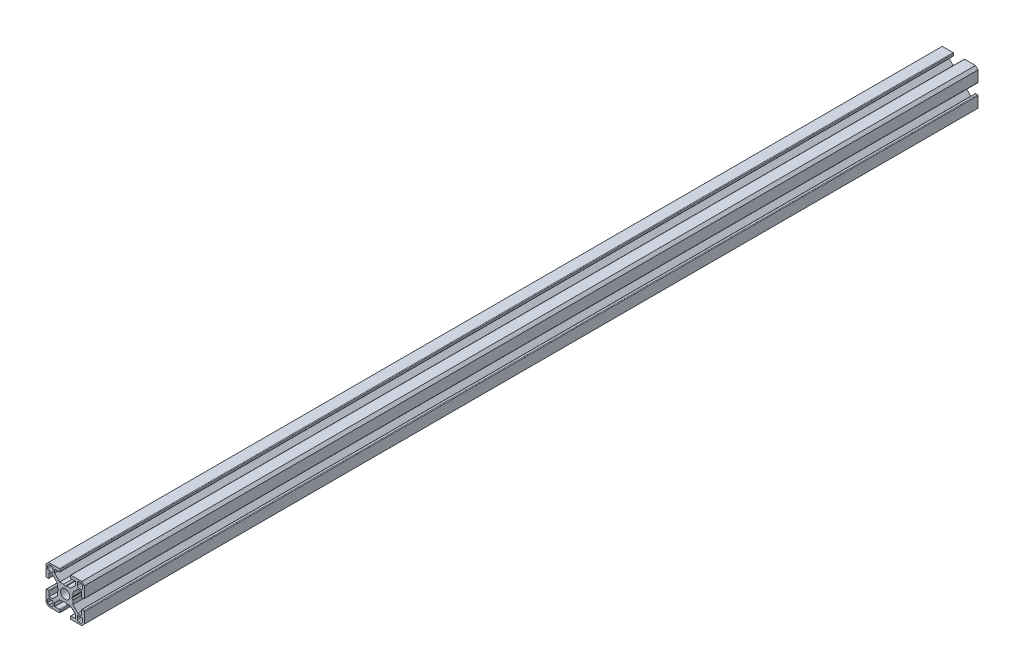
from build123d import *

# Parameters (mm, degrees)
BOSS_EXTRUDE1_DEPTH = 350
CIRPATTERN1_COUNT   = 4


with BuildPart() as part:
    # Sketch1 → Boss-Extrude1 (new, symmetric)
    with BuildSketch(Plane(origin=(0, 0, 0), x_dir=(0, -1, 0), z_dir=(0, 0, 1))):
        with BuildLine():
            Line((0, 5.3), (0, 3.65))
            ThreePointArc((0, 3.65), (-2.580939751, 2.580939751), (-3.65, 0))
            Line((-3.65, 0), (-5.3, 0))
            Line((-5.3, 0), (-6, 1.25))
            Line((-6, 1.25), (-6, 4.232224593))
            Line((-6, 4.232224593), (-10.01775891, 8.249983504))
            Line((-10.01775891, 8.249983504), (-12.68, 8.249983504))
            Line((-12.68, 8.249983504), (-12.68, 4.549990808))
            ThreePointArc((-12.68, 4.549990808), (-12.826446609, 4.196437418), (-13.18, 4.049990808))
            Line((-13.18, 4.049990808), (-14.5, 4.049990808))
            ThreePointArc((-14.5, 4.049990808), (-14.853553391, 4.196437418), (-15, 4.549990808))
            Line((-15, 4.549990808), (-15, 13))
            Line((-15, 13), (-13, 15))
            Line((-13, 15), (-4.549990808, 15))
            ThreePointArc((-4.549990808, 15), (-4.196437418, 14.853553391), (-4.049990808, 14.5))
            Line((-4.049990808, 14.5), (-4.049990808, 13.18))
            ThreePointArc((-4.049990808, 13.18), (-4.196437418, 12.826446609), (-4.549990808, 12.68))
            Line((-4.549990808, 12.68), (-8.249983504, 12.68))
            Line((-8.249983504, 12.68), (-8.249983504, 10.01775891))
            Line((-8.249983504, 10.01775891), (-4.232224593, 6))
            Line((-4.232224593, 6), (-1.25, 6))
            Line((-1.25, 6), (0, 5.3))
        make_face()
        with BuildLine():
            Line((-10.5, 9.5), (-12.7, 9.5))
            ThreePointArc((-12.7, 9.5), (-13.407106781, 9.792893219), (-13.7, 10.5))
            Line((-13.7, 10.5), (-13.7, 12.461522369))
            Line((-13.7, 12.461522369), (-12.461522369, 13.7))
            Line((-12.461522369, 13.7), (-10.5, 13.7))
            ThreePointArc((-10.5, 13.7), (-9.792893219, 13.407106781), (-9.5, 12.7))
            Line((-9.5, 12.7), (-9.5, 10.5))
            ThreePointArc((-9.5, 10.5), (-9.792893219, 9.792893219), (-10.5, 9.5))
        make_face(mode=Mode.SUBTRACT)
    boss_extrude1 = extrude(amount=BOSS_EXTRUDE1_DEPTH, both=True)

    # CirPattern1: Boss-Extrude1 ×4 about axis
    cirpattern1_axis = Axis((0, 0, 330), (0, 0, -1))
    for i in range(1, CIRPATTERN1_COUNT):
        add(boss_extrude1.rotate(cirpattern1_axis, i * 360 / CIRPATTERN1_COUNT))


solid = part.part
